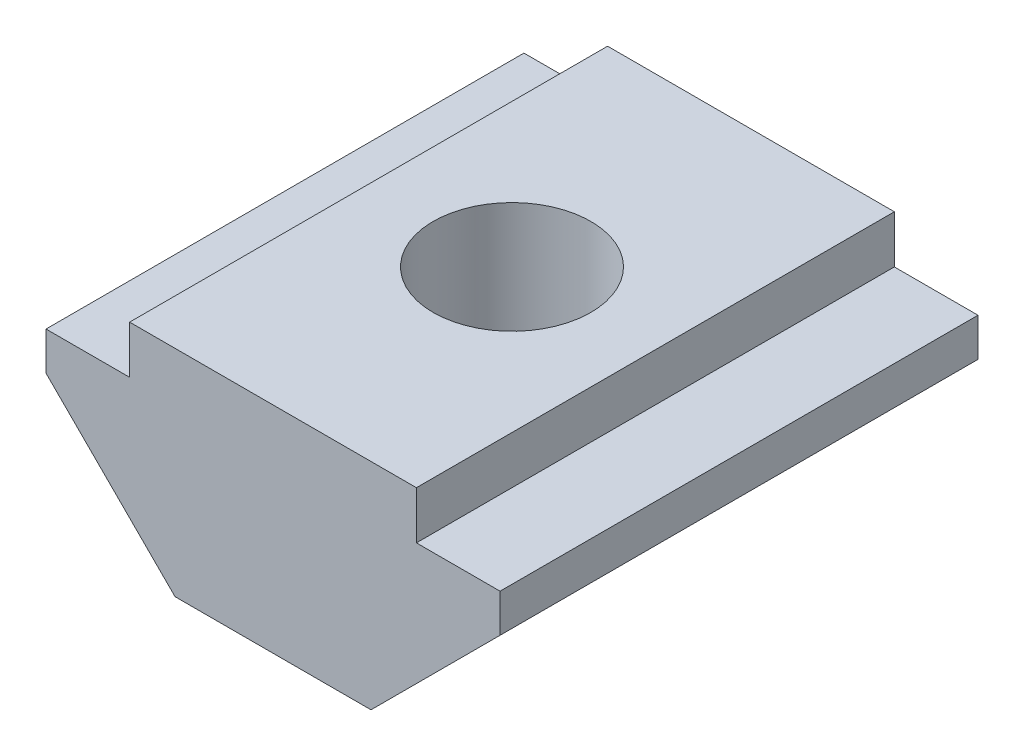
from build123d import *

# Parameters (mm, degrees)
SKETCH_1_W      = 6
SKETCH_1_H      = 1
EXTRUDE_1_DEPTH = 5
HOLE_WIZARD_0_D = 3.3


with BuildPart() as part:
    # 草图1 → 凸台-拉伸1 (new, symmetric)
    with BuildSketch(Plane.XY):
        Polygon((2.05, -0.813970588), (-2.05, -0.813970588), (-4.75, 1.886029412), (-4.75, 2.686029412), (4.75, 2.686029412), (4.75, 1.886029412), align=None)
        with Locations((0, 3.186029412)):
            Rectangle(SKETCH_1_W, SKETCH_1_H)
    extrude(amount=EXTRUDE_1_DEPTH, both=True)

    # Hole Wizard 0 (through all)
    with Locations(Plane(origin=(0, 3.686029412, 0), x_dir=(1, 0, 0), z_dir=(0, 1, 0))):
        with Locations((0, 0)):
            Hole(HOLE_WIZARD_0_D / 2)


solid = part.part
